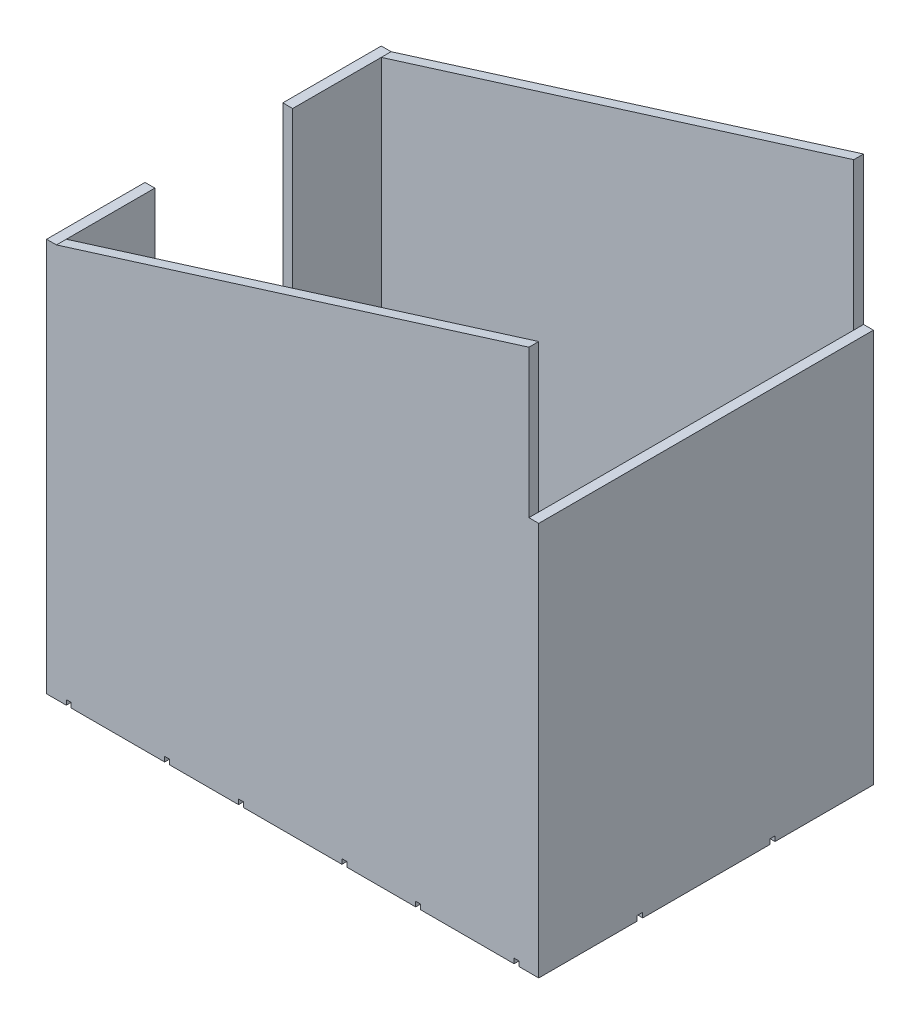
from build123d import *

# Parameters (mm, degrees)
EXTRUDE_1_DEPTH     = 3
EXTRUDE_2_DEPTH     = 77
SKETCH_3_W          = 96
SKETCH_3_H          = 2
EXTRUDE_3_DEPTH     = 30
CUT_EXTRUDE_1_DEPTH = 164.474768695
EXTRUDE_4_DEPTH     = 3
SKETCH_8_R          = 2
CUT_EXTRUDE_2_DEPTH = 3
SKETCH_9_R          = 1.15
CUT_EXTRUDE_3_DEPTH = 23
SKETCH_10_W         = 1
SKETCH_10_H         = 68
CUT_EXTRUDE_4_DEPTH = 1
SKETCH_11_W         = 100
SKETCH_11_H         = 1.130513839
SKETCH_11_H_2       = 1
CUT_EXTRUDE_5_DEPTH = 1


with BuildPart() as part:
    # 草图1 → 凸台-拉伸1 (new body)
    with BuildSketch(Plane(origin=(0, 0, 0), x_dir=(1, 0, 0), z_dir=(0, 1, 0))):
        with BuildLine():
            Line((0, 0), (0, -20))
            Line((0, -20), (60, -20))
            ThreePointArc((60, -20), (74, -34), (60, -48))
            Line((60, -48), (0, -48))
            Line((0, -48), (0, -68))
            Line((0, -68), (100, -68))
            Line((100, -68), (100, 0))
            Line((100, 0), (0, 0))
        make_face()
    extrude(amount=EXTRUDE_1_DEPTH)

    # 草图2 → 凸台-拉伸2 (add)
    with BuildSketch(Plane(origin=(0, 3, 0), x_dir=(1, 0, 0), z_dir=(0, 1, 0))):
        Polygon((2, -20), (0, -20), (0, 0), (100, 0), (100, -68), (0, -68), (0, -48), (2, -48), (2, -66), (98, -66), (98, -2), (2, -2), align=None)
    extrude(amount=EXTRUDE_2_DEPTH)

    # 草图3 → 凸台-拉伸3 (add)
    with BuildSketch(Plane(origin=(0, 80, 0), x_dir=(1, 0, 0), z_dir=(0, 1, 0))):
        with Locations((50, -1)):
            Rectangle(SKETCH_3_W, SKETCH_3_H)
        with Locations((50, -67)):
            Rectangle(SKETCH_3_W, SKETCH_3_H)
    extrude(amount=EXTRUDE_3_DEPTH)

    # 草图6 → 切除-拉伸1 (cut, through all)
    with BuildSketch(Plane.XY.offset(68)):
        Polygon((2, 110), (2, 80), (98, 110), align=None)
    extrude(amount=-CUT_EXTRUDE_1_DEPTH, mode=Mode.SUBTRACT)

    # 草图7 → 凸台-拉伸4 (add)
    with BuildSketch(Plane(origin=(0, 3, 0), x_dir=(1, 0, 0), z_dir=(0, 1, 0))):
        with BuildLine():
            Line((98, -2), (2, -2))
            Line((2, -2), (2, -20))
            Line((2, -20), (60, -20))
            ThreePointArc((60, -20), (74, -34), (60, -48))
            Line((60, -48), (2, -48))
            Line((2, -48), (2, -66))
            Line((2, -66), (98, -66))
            Line((98, -66), (98, -2))
        make_face()
    extrude(amount=EXTRUDE_4_DEPTH)

    # 草图8 → 切除-拉伸2 (cut)
    with BuildSketch(Plane(origin=(0, 6, 0), x_dir=(1, 0, 0), z_dir=(0, 1, 0))):
        with Locations(Location((15, -9, 0), (0, 0, 270))):
            Circle(SKETCH_8_R)
        with Locations(Location((50, -9, 0), (0, 0, 270))):
            Circle(SKETCH_8_R)
        with Locations(Location((85, -9, 0), (0, 0, 270))):
            Circle(SKETCH_8_R)
        with Locations(Location((15, -59, 0), (0, 0, 270))):
            Circle(SKETCH_8_R)
        with Locations(Location((50, -59, 0), (0, 0, 270))):
            Circle(SKETCH_8_R)
        with Locations(Location((85, -59, 0), (0, 0, 270))):
            Circle(SKETCH_8_R)
    extrude(amount=-CUT_EXTRUDE_2_DEPTH, mode=Mode.SUBTRACT)

    # 草图9 → 切除-拉伸3 (cut)
    with BuildSketch(Plane(origin=(0, 6, 0), x_dir=(1, 0, 0), z_dir=(0, 1, 0))):
        with Locations(Location((15, -9, 0), (0, 0, 270))):
            Circle(SKETCH_9_R)
        with Locations(Location((50, -9, 0), (0, 0, 270))):
            Circle(SKETCH_9_R)
        with Locations(Location((85, -9, 0), (0, 0, 270))):
            Circle(SKETCH_9_R)
        with Locations(Location((85, -59, 0), (0, 0, 270))):
            Circle(SKETCH_9_R)
        with Locations(Location((50, -59, 0), (0, 0, 270))):
            Circle(SKETCH_9_R)
        with Locations(Location((15, -59, 0), (0, 0, 270))):
            Circle(SKETCH_9_R)
    extrude(amount=-CUT_EXTRUDE_3_DEPTH, mode=Mode.SUBTRACT)

    # 草图10 → 切除-拉伸4 (cut)
    with BuildSketch(Plane.XZ):
        with Locations((24.5, 34)):
            Rectangle(SKETCH_10_W, SKETCH_10_H)
        with Locations((39.5, 34)):
            Rectangle(SKETCH_10_W, SKETCH_10_H)
        with Locations((60.5, 34)):
            Rectangle(SKETCH_10_W, SKETCH_10_H)
        with Locations((75.5, 34)):
            Rectangle(SKETCH_10_W, SKETCH_10_H)
        with Locations((95.5, 34)):
            Rectangle(SKETCH_10_W, SKETCH_10_H)
        with Locations((4.5, 34)):
            Rectangle(SKETCH_10_W, SKETCH_10_H)
    extrude(amount=-CUT_EXTRUDE_4_DEPTH, mode=Mode.SUBTRACT)

    # 草图11 → 切除-拉伸5 (cut)
    with BuildSketch(Plane.XZ):
        with Locations((50, 47.43474308)):
            Rectangle(SKETCH_11_W, SKETCH_11_H)
        with Locations((50, 20.5)):
            Rectangle(SKETCH_11_W, SKETCH_11_H_2)
    extrude(amount=-CUT_EXTRUDE_5_DEPTH, mode=Mode.SUBTRACT)


solid = part.part
